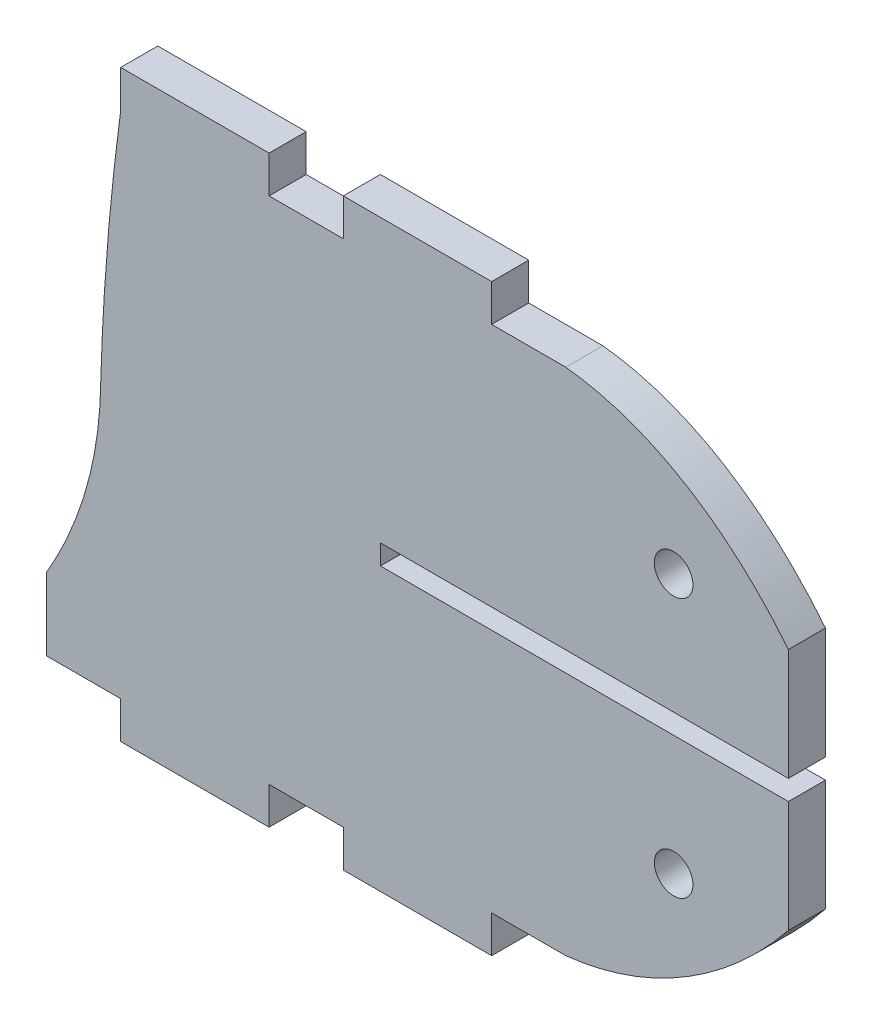
from build123d import *

# Parameters (mm, degrees)
SKETCH1_R           = 2.6
BOSS_EXTRUDE1_DEPTH = 5


with BuildPart() as part:
    # Sketch1 → Boss-Extrude1 (new body)
    with BuildSketch(Plane.XY):
        with BuildLine():
            Line((-144.395039413, -128.65), (-89.395039413, -128.65))
            Line((-89.395039413, -128.65), (-89.395039413, -113.602732617))
            add(Edge.make_bspline(
                [(-89.395039413, -113.602732617), (-96.831752604, -104.34489473), (-107.166514085, -96.997462442), (-119.395039413, -95.65)],
                knots=[0, 0, 0, 0, 1, 1, 1, 1], degree=3))
            Line((-119.395039413, -95.65), (-129.395039413, -95.65))
            Line((-129.395039413, -95.65), (-129.395039413, -90.65))
            Line((-129.395039413, -90.65), (-149.395039413, -90.65))
            Line((-149.395039413, -90.65), (-149.395039413, -95.65))
            Line((-149.395039413, -95.65), (-159.395039413, -95.65))
            Line((-159.395039413, -95.65), (-159.395039413, -90.65))
            Line((-159.395039413, -90.65), (-179.395039413, -90.65))
            Line((-179.395039413, -90.65), (-179.395039413, -95.65))
            add(Edge.make_bspline(
                [(-179.395039413, -95.65), (-181.601038643, -112.074647686), (-182.084492752, -128.65)],
                knots=[0, 0, 0, 1, 1, 1], degree=2))
            add(Edge.make_bspline(
                [(-182.084492752, -128.65), (-182.242729915, -142.32211305), (-189.395039413, -154.585895155)],
                knots=[0, 0, 0, 1, 1, 1], degree=2))
            Line((-189.395039413, -154.585895155), (-189.395039413, -164.35))
            Line((-189.395039413, -164.35), (-179.395039413, -164.35))
            Line((-179.395039413, -164.35), (-179.395039413, -169.35))
            Line((-179.395039413, -169.35), (-159.395039413, -169.35))
            Line((-159.395039413, -169.35), (-159.395039413, -164.35))
            Line((-159.395039413, -164.35), (-149.395039413, -164.35))
            Line((-149.395039413, -164.35), (-149.395039413, -169.35))
            Line((-149.395039413, -169.35), (-129.395039413, -169.35))
            Line((-129.395039413, -169.35), (-129.395039413, -164.35))
            Line((-129.395039413, -164.35), (-119.395039413, -164.35))
            add(Edge.make_bspline(
                [(-89.395039413, -146.397267383), (-96.831752604, -155.65510527), (-107.166514085, -163.002537558), (-119.395039413, -164.35)],
                knots=[0, 0, 0, 0, 1, 1, 1, 1], degree=3))
            Line((-89.395039413, -146.397267383), (-89.395039413, -131.35))
            Line((-89.395039413, -131.35), (-144.395039413, -131.35))
            Line((-144.395039413, -131.35), (-144.395039413, -128.65))
        make_face()
        with Locations((-104.860428981, -112.5)):
            Circle(SKETCH1_R, mode=Mode.SUBTRACT)
        with Locations((-104.860428981, -147.5)):
            Circle(SKETCH1_R, mode=Mode.SUBTRACT)
    extrude(amount=BOSS_EXTRUDE1_DEPTH)


solid = part.part
